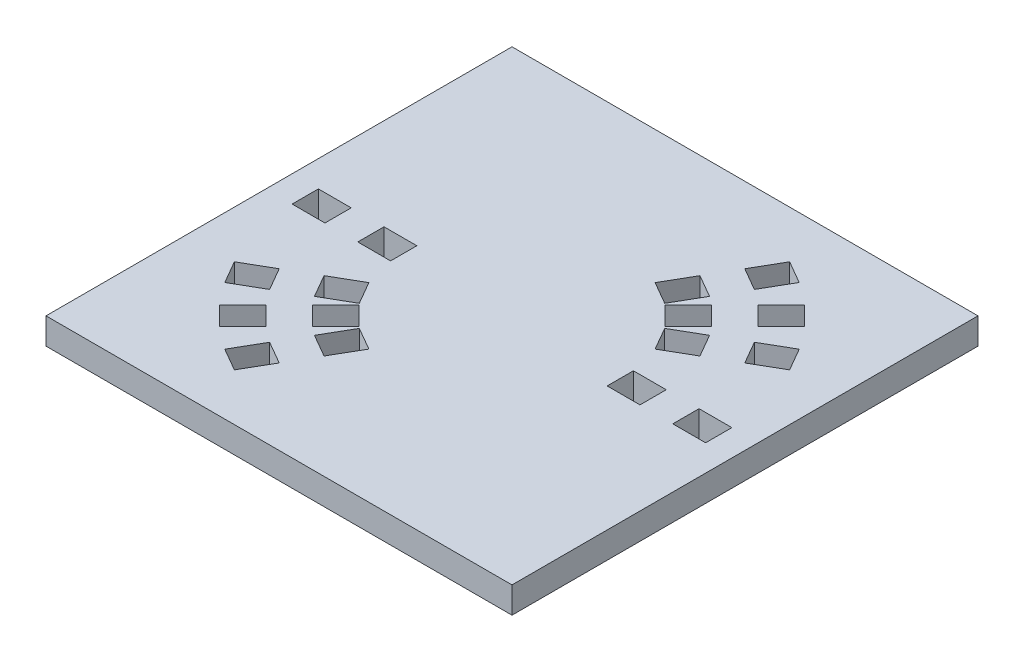
from build123d import *

# Parameters (mm, degrees)
SKETCH1_W           = 90.15984
SKETCH1_H           = 90.15984
SKETCH1_W_2         = 6.35
SKETCH1_H_2         = 5.08
BOSS_EXTRUDE1_DEPTH = 5.08


with BuildPart() as part:
    # Sketch1 → Boss-Extrude1 (new body)
    with BuildSketch(Plane(origin=(0, 0, 0), x_dir=(1, 0, 0), z_dir=(0, 1, 0))):
        with Locations((-1.415064753, -22.53996)):
            Rectangle(SKETCH1_W, SKETCH1_H)
        with Locations((-38.239984753, -22.53996)):
            Rectangle(SKETCH1_W_2, SKETCH1_H_2, mode=Mode.SUBTRACT)
        with Locations((-25.539984753, -22.53996)):
            Rectangle(SKETCH1_W_2, SKETCH1_H_2, mode=Mode.SUBTRACT)
        Polygon((20.784599772, 10.830986869), (17.609599772, 5.331725555), (13.210190721, 7.871725555), (16.385190721, 13.370986869), align=None, mode=Mode.SUBTRACT)
        Polygon((14.434599772, -0.167535759), (11.259599772, -5.666797073), (6.860190721, -3.126797073), (10.035190721, 2.372464241), align=None, mode=Mode.SUBTRACT)
        Polygon((28.66520115, 3.948203455), (24.175073089, -0.541924606), (20.582970641, 3.050177843), (25.073098701, 7.540305903), align=None, mode=Mode.SUBTRACT)
        Polygon((19.684945029, -5.032052666), (15.194816968, -9.522180727), (11.60271452, -5.930078278), (16.09284258, -1.439950218), align=None, mode=Mode.SUBTRACT)
        Polygon((34.495882116, -4.739704526), (28.996620802, -7.914704526), (26.456620802, -3.515295474), (31.955882116, -0.340295474), align=None, mode=Mode.SUBTRACT)
        Polygon((23.497359488, -11.089704526), (17.998098174, -14.264704526), (15.458098174, -9.865295474), (20.957359488, -6.690295474), align=None, mode=Mode.SUBTRACT)
        with Locations((35.409855247, -22.53996)):
            Rectangle(SKETCH1_W_2, SKETCH1_H_2, mode=Mode.SUBTRACT)
        with Locations((22.709855247, -22.53996)):
            Rectangle(SKETCH1_W_2, SKETCH1_H_2, mode=Mode.SUBTRACT)
        Polygon((-23.614729279, -55.910906869), (-20.439729279, -50.411645555), (-16.040320228, -52.951645555), (-19.215320228, -58.450906869), align=None, mode=Mode.SUBTRACT)
        Polygon((-17.264729279, -44.912384241), (-14.089729279, -39.413122927), (-9.690320228, -41.953122927), (-12.865320228, -47.452384241), align=None, mode=Mode.SUBTRACT)
        Polygon((-31.495330656, -49.028123455), (-27.005202596, -44.537995394), (-23.413100148, -48.130097843), (-27.903228208, -52.620225903), align=None, mode=Mode.SUBTRACT)
        Polygon((-22.515074535, -40.047867334), (-18.024946475, -35.557739273), (-14.432844026, -39.149841722), (-18.922972087, -43.639969782), align=None, mode=Mode.SUBTRACT)
        Polygon((-37.326011623, -40.340215474), (-31.826750309, -37.165215474), (-29.286750309, -41.564624526), (-34.786011623, -44.739624526), align=None, mode=Mode.SUBTRACT)
        Polygon((-26.327488995, -33.990215474), (-20.828227681, -30.815215474), (-18.288227681, -35.214624526), (-23.787488995, -38.389624526), align=None, mode=Mode.SUBTRACT)
    extrude(amount=BOSS_EXTRUDE1_DEPTH)


solid = part.part
